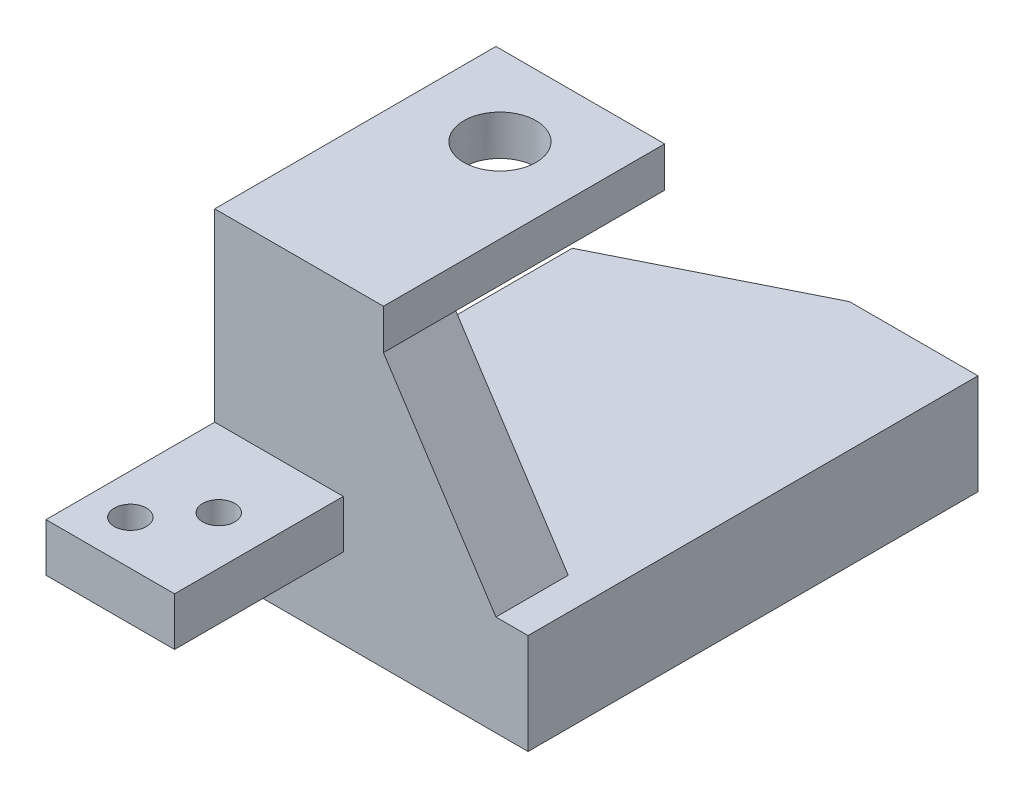
from build123d import *

# Parameters (mm, degrees)
BOSS_EXTRUDE1_DEPTH = 25
BOSS_EXTRUDE2_DEPTH = 18
SKETCH3_W           = 42
SKETCH3_H           = 10
BOSS_EXTRUDE3_DEPTH = 70
CUT_EXTRUDE1_REACH  = 194.188
SKETCH4_R           = 9
SKETCH5_W           = 42
SKETCH5_H           = 12
BOSS_EXTRUDE4_DEPTH = 32
CUT_EXTRUDE2_REACH  = 183.571
SKETCH6_R           = 4


with BuildPart() as part:
    # Sketch1 → Boss-Extrude1 (new body)
    with BuildSketch(Plane(origin=(0, 0, 0), x_dir=(1, 0, 0), z_dir=(0, 1, 0))):
        Polygon((57.307550645, 0), (135.307550645, 0), (135.307550645, 112), (103.307550645, 112), (57.307550645, 89), align=None)
    extrude(amount=-BOSS_EXTRUDE1_DEPTH)

    # Sketch2 → Boss-Extrude2 (add)
    with BuildSketch(Plane.XY):
        Polygon((57.307550645, 0), (127.307550645, 0), (99.307550645, 43), (99.307550645, 53), (57.307550645, 53), align=None)
    extrude(amount=-BOSS_EXTRUDE2_DEPTH)

    # Sketch3 → Boss-Extrude3 (add)
    with BuildSketch(Plane.XY):
        with Locations((78.307550645, 48)):
            Rectangle(SKETCH3_W, SKETCH3_H)
    extrude(amount=-BOSS_EXTRUDE3_DEPTH)

    # Sketch4 → Cut-Extrude1 (cut, up to next)
    with BuildSketch(Plane(origin=(0, 53, 0), x_dir=(1, 0, 0), z_dir=(0, 1, 0)), mode=Mode.PRIVATE) as cut_extrude1_sk1:
        with Locations(Location((78.307550645, 50, 0), (0, 0, 270))):
            Circle(SKETCH4_R)
    cut_extrude1_tool1 = extrude(cut_extrude1_sk1.sketch, amount=-CUT_EXTRUDE1_REACH, mode=Mode.PRIVATE) & part.part
    add(cut_extrude1_tool1.solids().sort_by_distance((78.307551, 53, -50))[0], mode=Mode.SUBTRACT)

    # Sketch5 → Boss-Extrude4 (add)
    with BuildSketch(Plane.ZY.offset(-57.307550645)):
        with Locations((21, 1)):
            Rectangle(SKETCH5_W, SKETCH5_H)
    extrude(amount=-BOSS_EXTRUDE4_DEPTH)

    # Sketch6 → Cut-Extrude2 (cut, up to next)
    with BuildSketch(Plane(origin=(0, 7, 0), x_dir=(1, 0, 0), z_dir=(0, 1, 0)), mode=Mode.PRIVATE) as cut_extrude2_sk1:
        with Locations(Location((67.307550645, -31, 0), (0, 0, 270))):
            Circle(SKETCH6_R)
    cut_extrude2_tool1 = extrude(cut_extrude2_sk1.sketch, amount=-CUT_EXTRUDE2_REACH, mode=Mode.PRIVATE) & part.part
    # Sketch6 → Cut-Extrude2 (cut, up to next)
    with BuildSketch(Plane(origin=(0, 7, 0), x_dir=(1, 0, 0), z_dir=(0, 1, 0)), mode=Mode.PRIVATE) as cut_extrude2_sk2:
        with Locations(Location((77.307550645, -19, 0), (0, 0, 270))):
            Circle(SKETCH6_R)
    cut_extrude2_tool2 = extrude(cut_extrude2_sk2.sketch, amount=-CUT_EXTRUDE2_REACH, mode=Mode.PRIVATE) & part.part
    add(cut_extrude2_tool1.solids().sort_by_distance((67.307551, 7, 31))[0], mode=Mode.SUBTRACT)
    add(cut_extrude2_tool2.solids().sort_by_distance((77.307551, 7, 19))[0], mode=Mode.SUBTRACT)


solid = part.part
